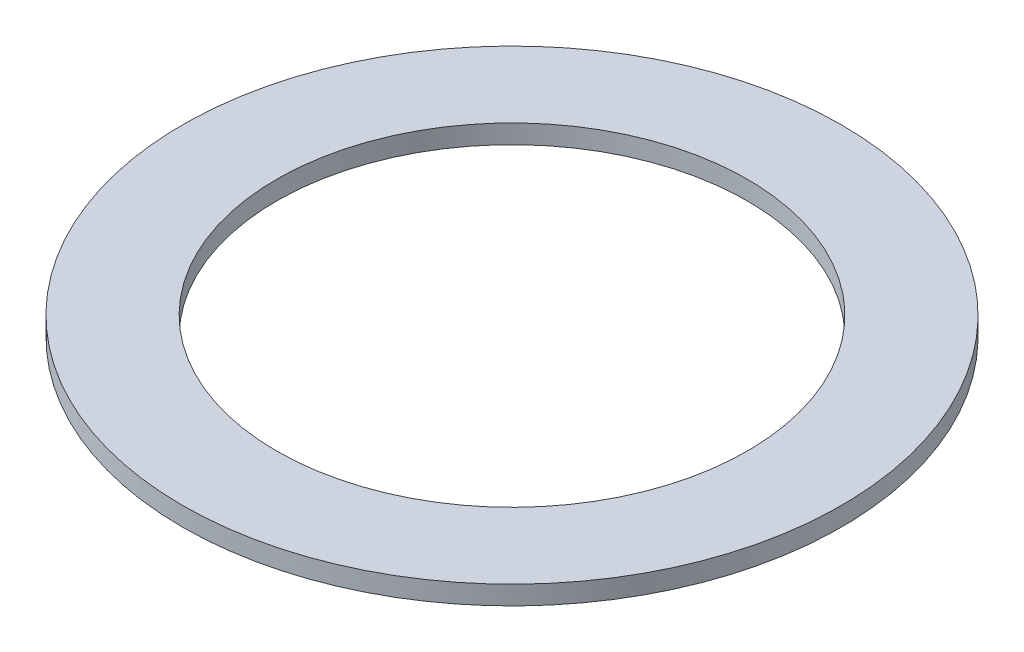
from build123d import *

# Parameters (mm, degrees)
SKETCH1_R           = 3.5
BOSS_EXTRUDE1_DEPTH = 0.2
SKETCH5_R           = 2.5
CUT_EXTRUDE1_DEPTH  = 5.953786431


with BuildPart() as part:
    # Sketch1 → Boss-Extrude1 (new body)
    with BuildSketch(Plane(origin=(0, 0, 0), x_dir=(1, 0, 0), z_dir=(0, 1, 0))):
        with Locations(Location((0, 0, 0), (0, 0, 270))):
            Circle(SKETCH1_R)
    extrude(amount=BOSS_EXTRUDE1_DEPTH)

    # Sketch5 → Cut-Extrude1 (cut, through all)
    with BuildSketch(Plane(origin=(0, 0.2, 0), x_dir=(-1, 0, 0), z_dir=(0, 1, 0))):
        with Locations(Location((0, 0, 0), (0, 0, 90))):
            Circle(SKETCH5_R)
    extrude(amount=-CUT_EXTRUDE1_DEPTH, mode=Mode.SUBTRACT)


solid = part.part
